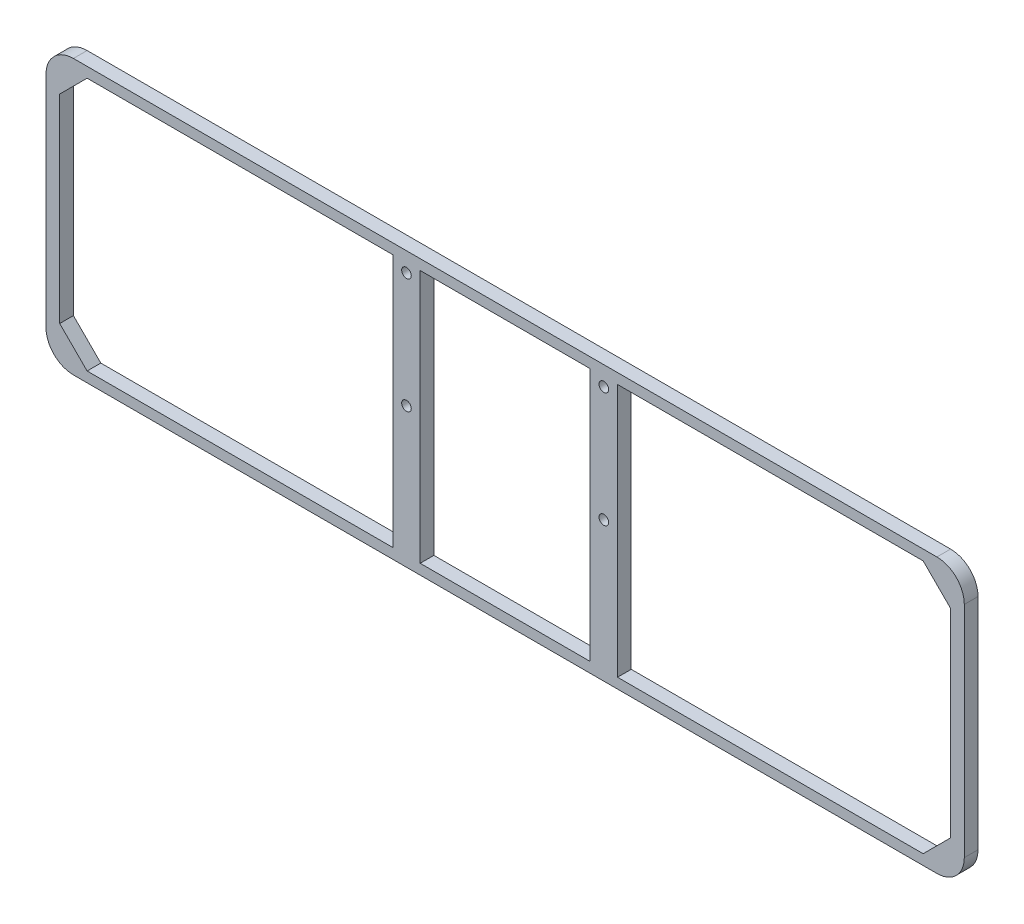
from build123d import *

# Parameters (mm, degrees)
SKETCH1_W           = 335
SKETCH1_H           = 100
SKETCH1_R           = 1.75
SKETCH1_W_2         = 62
SKETCH1_H_2         = 92.5
SKETCH1_W_3         = 121.5
BOSS_EXTRUDE1_DEPTH = 5
FILLET1_R           = 10
CHAMFER1_SIZE       = 10


with BuildPart() as part:
    # Sketch1 → Boss-Extrude1 (new body)
    with BuildSketch(Plane.XY):
        Rectangle(SKETCH1_W, SKETCH1_H)
        with Locations((-36, 43)):
            Circle(SKETCH1_R, mode=Mode.SUBTRACT)
        with Locations((36, 43)):
            Circle(SKETCH1_R, mode=Mode.SUBTRACT)
        with Locations((36, 1)):
            Circle(SKETCH1_R, mode=Mode.SUBTRACT)
        with Locations((-36, 1)):
            Circle(SKETCH1_R, mode=Mode.SUBTRACT)
        Rectangle(SKETCH1_W_2, SKETCH1_H_2, mode=Mode.SUBTRACT)
        with Locations((-101.75, 0)):
            Rectangle(SKETCH1_W_3, SKETCH1_H_2, mode=Mode.SUBTRACT)
        with Locations((101.75, 0)):
            Rectangle(SKETCH1_W_3, SKETCH1_H_2, mode=Mode.SUBTRACT)
    extrude(amount=-BOSS_EXTRUDE1_DEPTH)

    # Fillet1
    fillet1_edges = [part.edges().sort_by_distance(p)[0] for p in [
        (167.5, -50, -2.5),
        (-167.5, -50, -2.5),
        (-167.5, 50, -2.5),
        (167.5, 50, -2.5),
    ]]
    fillet(fillet1_edges, radius=FILLET1_R)

    # Chamfer1
    chamfer1_edges = [part.edges().sort_by_distance(p)[0] for p in [
        (162.5, 46.25, -2.5),
        (162.5, -46.25, -2.5),
        (-162.5, -46.25, -2.5),
        (-162.5, 46.25, -2.5),
    ]]
    chamfer(chamfer1_edges, length=CHAMFER1_SIZE)


solid = part.part
